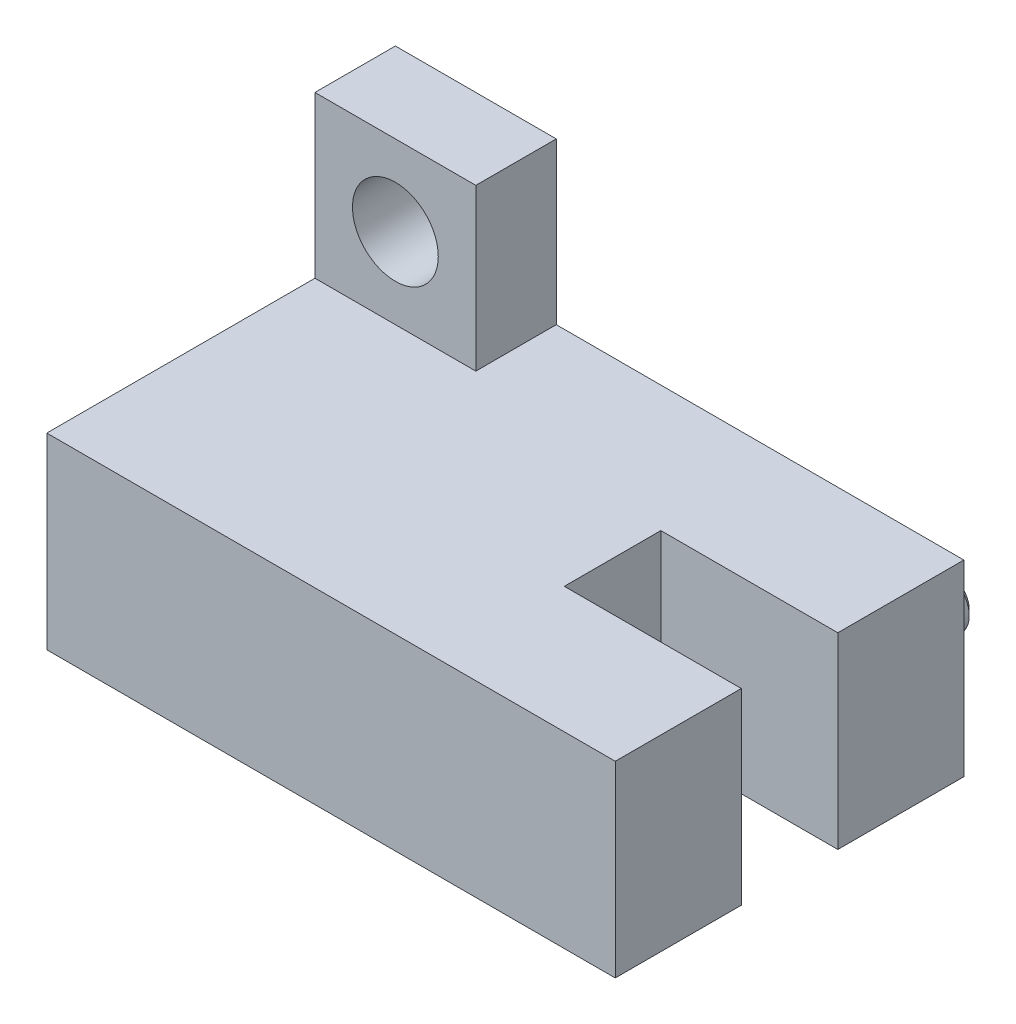
from build123d import *

# Parameters (mm, degrees)
SKETCH_1_W          = 6
SKETCH_1_H          = 13
SKETCH_1_R          = 1.6
EXTRUDE_1_DEPTH     = 3
SKETCH_3_W          = 21.2
SKETCH_3_H          = 7
EXTRUDE_3_DEPTH     = 13
SKETCH_4_W          = 10.937812939
SKETCH_4_H          = 3.6
CUT_EXTRUDE_1_DEPTH = 13.2
SKETCH_6_R          = 1
EXTRUDE_4_DEPTH     = 2
CHAMFER_1_SIZE      = 0.2


with BuildPart() as part:
    # 草图1 → 拉伸1 (new body)
    with BuildSketch(Plane.XY):
        with Locations((0, 6)):
            Rectangle(SKETCH_1_W, SKETCH_1_H)
        with Locations((0, 9.5)):
            Circle(SKETCH_1_R, mode=Mode.SUBTRACT)
    extrude(amount=EXTRUDE_1_DEPTH)

    # 草图3 → 拉伸3 (add)
    with BuildSketch(Plane(origin=(0, 0, 0), x_dir=(-1, 0, 0), z_dir=(0, 0, -1))):
        with Locations((-7.6, 3)):
            Rectangle(SKETCH_3_W, SKETCH_3_H)
    extrude(amount=-EXTRUDE_3_DEPTH)

    # 草图4 → 切除-拉伸1 (cut)
    with BuildSketch(Plane(origin=(0, 6.5, 0), x_dir=(-1, 0, 0), z_dir=(0, 1, 0))):
        with Locations((-17.068906469, 6.5)):
            Rectangle(SKETCH_4_W, SKETCH_4_H)
    extrude(amount=-CUT_EXTRUDE_1_DEPTH, mode=Mode.SUBTRACT)

    # 草图6 → 拉伸4 (add)
    with BuildSketch(Plane(origin=(0, 0, 0), x_dir=(-1, 0, 0), z_dir=(0, 0, -1))):
        with Locations(Location((-15.6, 3, 0), (0, 0, 180))):
            Circle(SKETCH_6_R)
    extrude(amount=EXTRUDE_4_DEPTH)

    # 倒角1
    chamfer_1_edges = [part.edges().sort_by_distance(p)[0] for p in [
        (14.6, 3, -2),
    ]]
    chamfer(chamfer_1_edges, length=CHAMFER_1_SIZE)


solid = part.part
